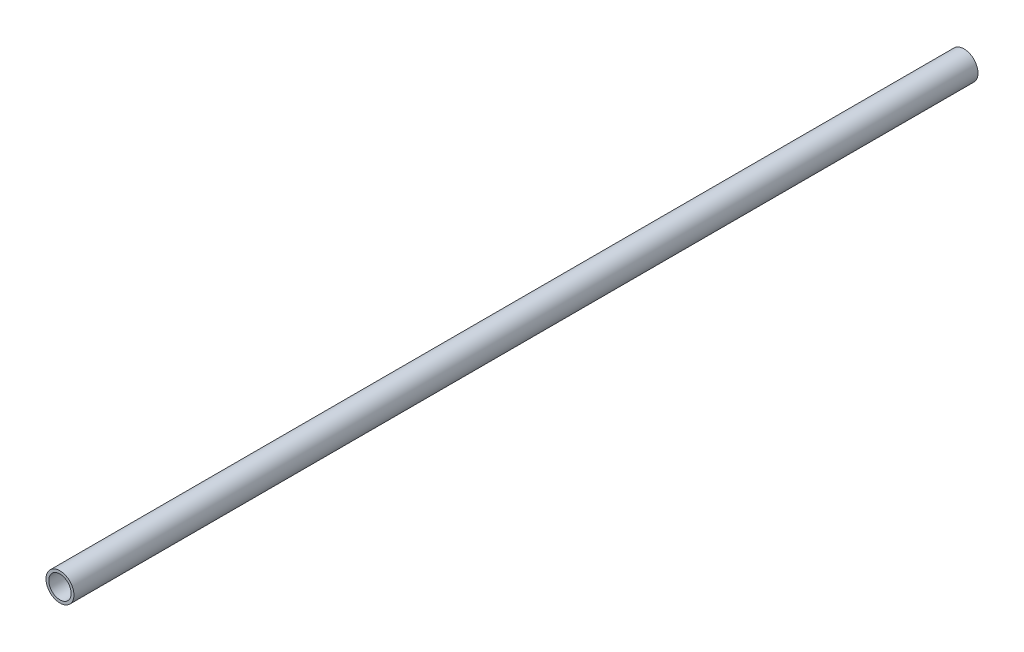
from build123d import *

# Parameters (mm, degrees)
IZIM1_R                     = 2.5
Y_KSEKLIK_EKSTR_ZYON1_DEPTH = 161.5
IZIM2_R                     = 2
KES_EKSTR_ZYON1_DEPTH       = 200


with BuildPart() as part:
    # Çizim1 → Yükseklik-Ekstrüzyon1 (new body)
    with BuildSketch(Plane.XY):
        Circle(IZIM1_R)
    extrude(amount=Y_KSEKLIK_EKSTR_ZYON1_DEPTH)

    # Çizim2 → Kes-Ekstrüzyon1 (cut)
    with BuildSketch(Plane.XY.offset(161.5)):
        Circle(IZIM2_R)
    extrude(amount=-KES_EKSTR_ZYON1_DEPTH, mode=Mode.SUBTRACT)


solid = part.part
